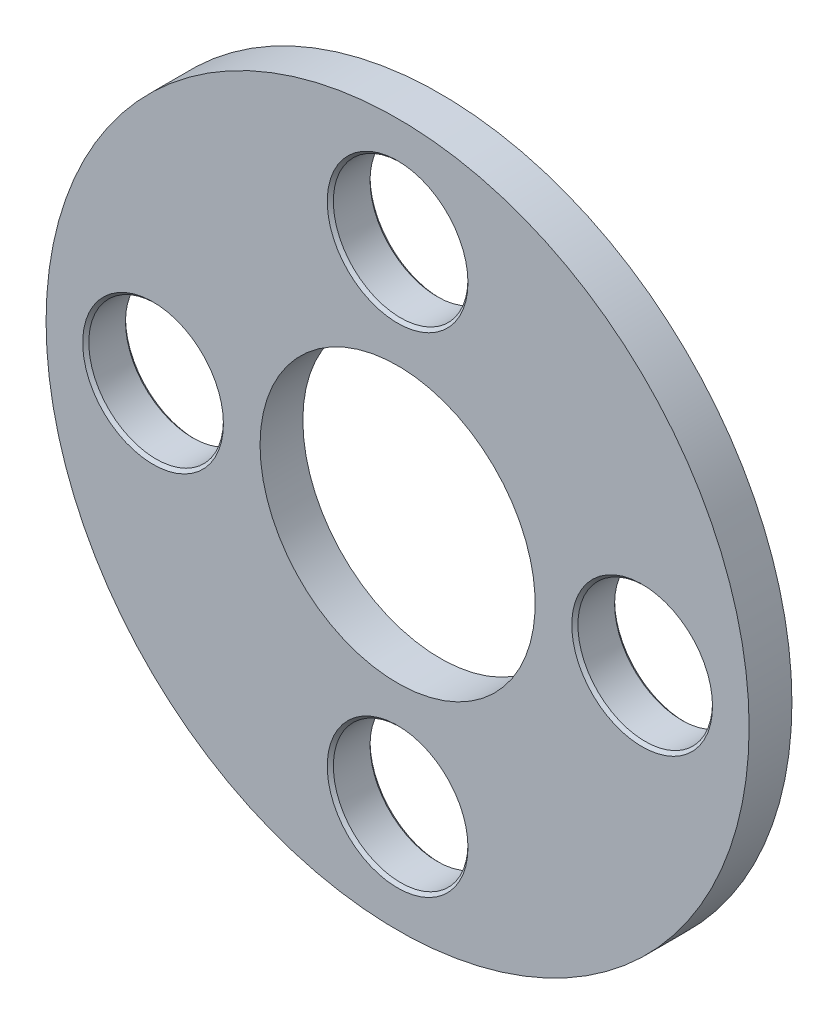
from build123d import *

# Parameters (mm, degrees)
SKETCH3_R                    = 57.5
SKETCH3_R_2                  = 22.5
BOSS_EXTRUDE2_DEPTH          = 7
SKETCH12_R                   = 11.01
CUT_EXTRUDE7_DEPTH           = 82.618012718
CHAMFER5_SIZE                = 0.5
CIRPATTERN4_COUNT            = 4
CHAMFER5_OF_CIRPATTERN4_SIZE = 0.5


with BuildPart() as part:
    # Sketch3 → Boss-Extrude2 (new body)
    with BuildSketch(Plane(origin=(0, 0, 0), x_dir=(-1, 0, 0), z_dir=(0, 0, -1))):
        Circle(SKETCH3_R)
        Circle(SKETCH3_R_2, mode=Mode.SUBTRACT)
    extrude(amount=BOSS_EXTRUDE2_DEPTH)

    # Sketch12 → Cut-Extrude7 (cut, through all)
    with BuildSketch(Plane.XY):
        with Locations((-40, 0)):
            Circle(SKETCH12_R)
    cut_extrude7 = extrude(amount=-CUT_EXTRUDE7_DEPTH, mode=Mode.SUBTRACT)

    # Chamfer5
    chamfer5_edges = [part.edges().sort_by_distance(p)[0] for p in [
        (-51.01, 0, -7),
        (-51.01, 0, 0),
    ]]
    chamfer(chamfer5_edges, length=CHAMFER5_SIZE)

    # CirPattern4: Cut-Extrude7 ×4 about axis
    cirpattern4_axis = Axis((0, 0, -7), (0, 0, 1))
    for i in range(1, CIRPATTERN4_COUNT):
        add(cut_extrude7.rotate(cirpattern4_axis, i * 360 / CIRPATTERN4_COUNT), mode=Mode.SUBTRACT)

    # Chamfer5 of CirPattern4
    chamfer5_of_cirpattern4_edges = [part.edges().sort_by_distance(p)[0] for p in [
        (0, -51.01, -7),
        (0, -51.01, 0),
        (51.01, 0, -7),
        (51.01, 0, 0),
        (0, 51.01, -7),
        (0, 51.01, 0),
    ]]
    chamfer(chamfer5_of_cirpattern4_edges, length=CHAMFER5_OF_CIRPATTERN4_SIZE)


solid = part.part
